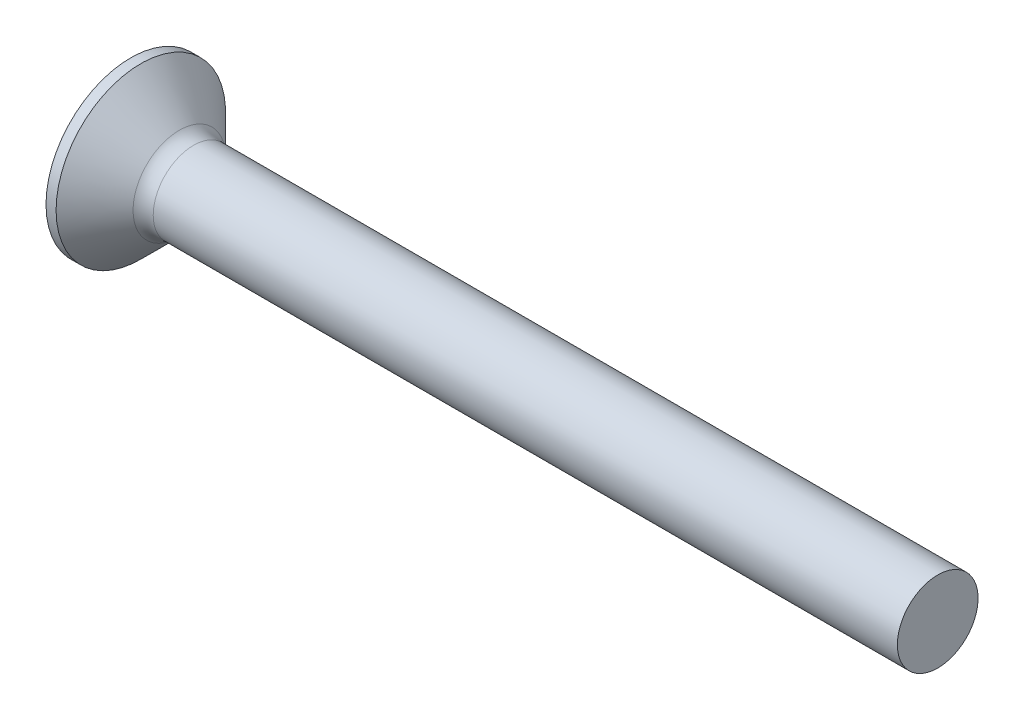
from build123d import *

# Parameters (mm, degrees)
FILLET1_R    = 1
RECPAT_COUNT = 2
RECPAT_ANGLE = 90


with BuildPart() as part:
    # BodySke → Base-Revolve (revolve)
    with BuildSketch(Plane.XY, mode=Mode.PRIVATE) as base_revolve_sk:
        Polygon((0, 0), (0, 4.2), (0.5, 4.2), (2.7, 2), (40, 2), (40, 0), align=None)
    revolve(base_revolve_sk.sketch.rotate(Axis((-6.35, 0, 0), (1, 0, 0)), 90), axis=Axis((-6.35, 0, 0), (1, 0, 0)))

    # Fillet1
    fillet1_edges = [part.edges().sort_by_distance(p)[0] for p in [
        (2.7, 0, -2),
    ]]
    fillet(fillet1_edges, radius=FILLET1_R)

    # Sketch3 → Recess section 0
    with BuildSketch(Plane.ZY):
        with BuildLine():
            Line((-0.515, 2.2), (0.515, 2.2))
            Line((0.515, 2.2), (0.515, -2.2))
            Line((0.515, -2.2), (-0.515, -2.2))
            Line((-0.515, -2.2), (-0.515, 2.2))
        make_face()
    # Sketch4 → Recess section 1
    with BuildSketch(Plane.ZY.offset(-2.51)):
        with BuildLine():
            Line((-0.515, 0.948560373), (0.515, 0.948560373))
            Line((0.515, 0.948560373), (0.515, -0.948560373))
            Line((0.515, -0.948560373), (-0.515, -0.948560373))
            Line((-0.515, -0.948560373), (-0.515, 0.948560373))
        make_face()
    recess = loft(mode=Mode.SUBTRACT)

    # RecPat: Recess ×2 about axis
    recpat_axis = Axis((0, 0, 0), (1, 0, 0))
    for i in range(1, RECPAT_COUNT):
        add(recess.rotate(recpat_axis, i * RECPAT_ANGLE / (RECPAT_COUNT - 1)), mode=Mode.SUBTRACT)

    # RecCorSke → RecessCore (revolve, cut)
    with BuildSketch(Plane.XY, mode=Mode.PRIVATE) as recesscore_sk:
        Polygon((0, 0), (0, 1.026516298), (2.51, 0.851), (2.786506661, 0), align=None)
    revolve(recesscore_sk.sketch.rotate(Axis((-3.175, 0, 0), (1, 0, 0)), 90), axis=Axis((-3.175, 0, 0), (1, 0, 0)), mode=Mode.SUBTRACT)


solid = part.part
